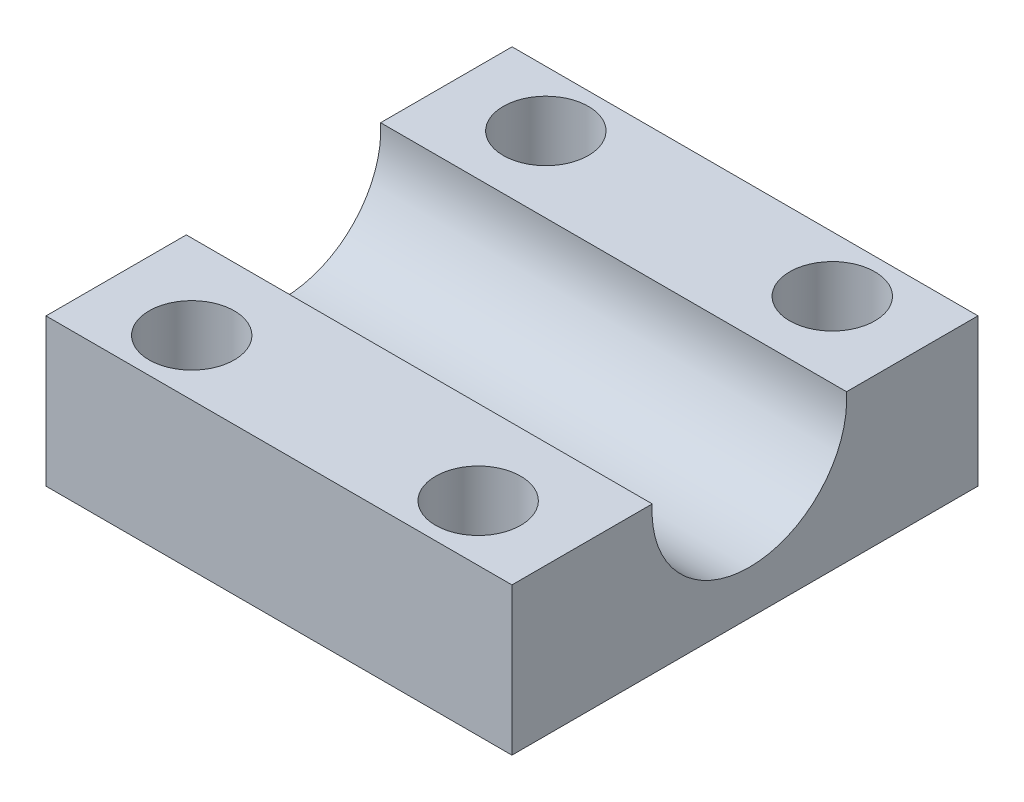
from build123d import *

# Parameters (mm, degrees)
SKETCH1_W                            = 38.29
SKETCH1_H                            = 38.3
BOSS_EXTRUDE1_DEPTH                  = 12.12
SKETCH2_R                            = 8
CUT_EXTRUDE1_DEPTH                   = 45.494280531
M8X1_0_TAPPED_HOLE2_D                = 7
MIRROR1_AT_THE_SECOND_PLANE_COPY_1_D = 7


with BuildPart() as part:
    # Sketch1 → Boss-Extrude1 (new body)
    with BuildSketch(Plane(origin=(0, 0, 0), x_dir=(1, 0, 0), z_dir=(0, 1, 0))):
        Rectangle(SKETCH1_W, SKETCH1_H)
    extrude(amount=BOSS_EXTRUDE1_DEPTH)

    # Sketch2 → Cut-Extrude1 (cut, through all)
    with BuildSketch(Plane(origin=(19.145, 0, 0), x_dir=(0, 0, -1), z_dir=(1, 0, 0))):
        with Locations((0.363834185, 11.62)):
            Circle(SKETCH2_R)
    extrude(amount=-CUT_EXTRUDE1_DEPTH, mode=Mode.SUBTRACT)

    # M8x1.0 Tapped Hole2 (through all)
    with Locations(Plane(origin=(0, 12.12, 0), x_dir=(1, 0, 0), z_dir=(0, 1, 0))):
        with Locations((-11.77, 14.55), (11.77, 14.55), (-11.77, -14.55), (11.77, -14.55)):
            m8x1_0_tapped_hole2 = Hole(M8X1_0_TAPPED_HOLE2_D / 2)

    # Mirror1: M8x1.0 Tapped Hole2 across plane
    add(m8x1_0_tapped_hole2.mirror(Plane.XY), mode=Mode.SUBTRACT)

    # Mirror1 at the second plane: M8x1.0 Tapped Hole2 across plane
    add(m8x1_0_tapped_hole2.mirror(Plane(origin=(0, 0, 0), x_dir=(0, 0, 1), z_dir=(1, 0, 0))), mode=Mode.SUBTRACT)

    # Mirror1 at the second plane copy 1 (through all)
    with Locations(Plane(origin=(0, 12.12, 0), x_dir=(-1, 0, 0), z_dir=(0, 1, 0))):
        with Locations((-11.77, 14.55), (11.77, 14.55), (-11.77, -14.55), (11.77, -14.55)):
            Hole(MIRROR1_AT_THE_SECOND_PLANE_COPY_1_D / 2)


solid = part.part
